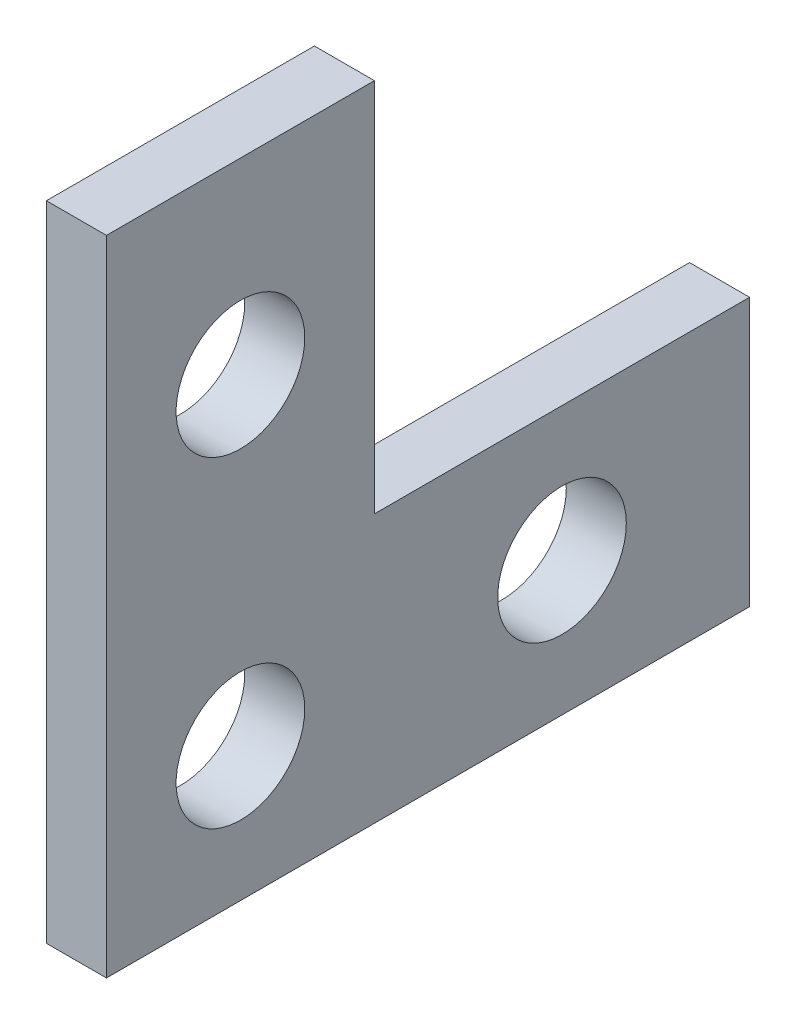
from build123d import *

# Parameters (mm, degrees)
SALIENTE_EXTRUIR1_DEPTH = 0.7
CROQUIS2_R              = 1.5
CORTAR_EXTRUIR1_DEPTH   = 10


with BuildPart() as part:
    # Croquis1 → Saliente-Extruir1 (new, symmetric)
    with BuildSketch(Plane(origin=(0, 0, 0), x_dir=(0, 0, -1), z_dir=(1, 0, 0))):
        Polygon((-7.5, 7.5), (-7.5, -7.5), (7.5, -7.5), (7.5, -1.25), (-1.25, -1.25), (-1.25, 7.5), align=None)
    extrude(amount=SALIENTE_EXTRUIR1_DEPTH, both=True)

    # Croquis2 → Cortar-Extruir1 (cut, symmetric)
    with BuildSketch(Plane(origin=(0.7, 0, 0), x_dir=(0, 0, -1), z_dir=(1, 0, 0))):
        with Locations((-4.375, -4.375)):
            Circle(CROQUIS2_R)
        with Locations((-4.375, 3.125)):
            Circle(CROQUIS2_R)
        with Locations((3.125, -4.375)):
            Circle(CROQUIS2_R)
    extrude(amount=CORTAR_EXTRUIR1_DEPTH, both=True, mode=Mode.SUBTRACT)


solid = part.part
